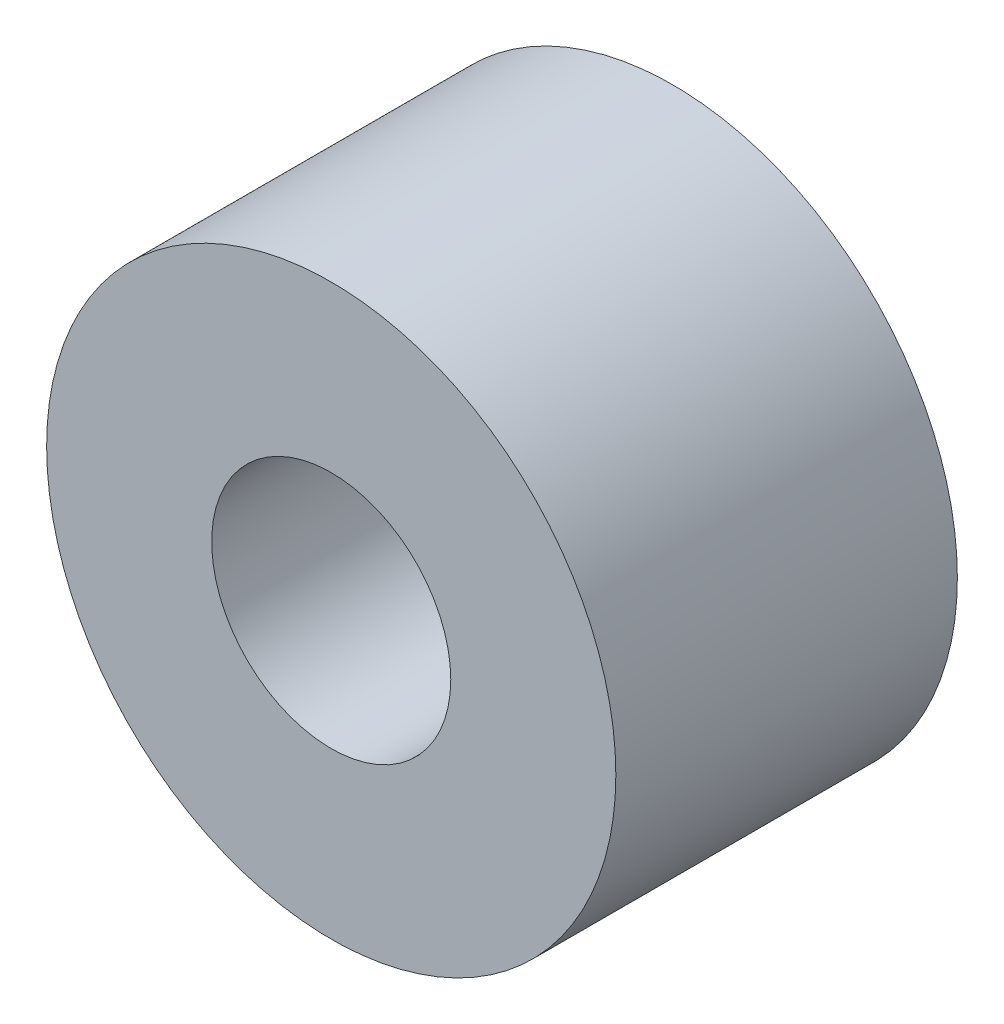
from build123d import *

# Parameters (mm, degrees)
SKETCH_1_R                 = 10
SKETCH_1_R_2               = 4.2
HAND_KNOB_SIMPLIFIED_DEPTH = 12


with BuildPart() as part:
    # 草图1 → Hand_knob_simplified (new body)
    with BuildSketch(Plane.XY):
        Circle(SKETCH_1_R)
        Circle(SKETCH_1_R_2, mode=Mode.SUBTRACT)
    extrude(amount=HAND_KNOB_SIMPLIFIED_DEPTH)


solid = part.part
